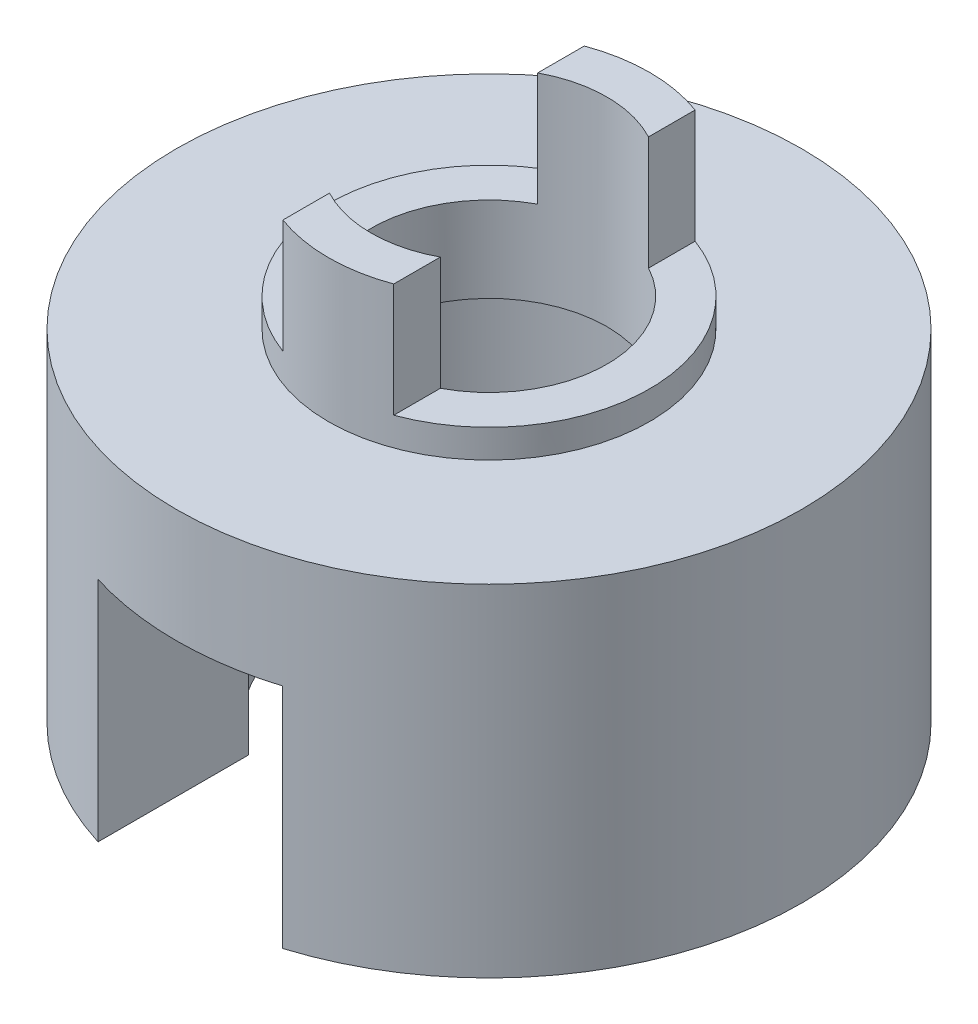
from build123d import *

# Parameters (mm, degrees)
SKETCH_1_R          = 11
SKETCH_1_R_2        = 4.15
EXTRUDE_1_DEPTH     = 2
EXTRUDE_START       = 5
SKETCH_1_3_R        = 5.65
SKETCH_1_3_R_2      = 4.15
EXTRUDE_2_DEPTH     = 5
CUT_EXTRUDE_1_DEPTH = 4
SKETCH_4_R          = 11
SKETCH_4_R_2        = 6.15
EXTRUDE_3_DEPTH     = 10
CUT_EXTRUDE_START   = -8
SKETCH_5_W          = 5.562300803
SKETCH_5_H          = 5
CUT_EXTRUDE_2_DEPTH = 8


with BuildPart() as part:
    # 草图1 → 凸台-拉伸1 (new body)
    with BuildSketch(Plane(origin=(0, 0, 0), x_dir=(1, 0, 0), z_dir=(0, 1, 0))):
        Circle(SKETCH_1_R)
        Circle(SKETCH_1_R_2, mode=Mode.SUBTRACT)
    extrude(amount=-EXTRUDE_1_DEPTH)

    # 草图1<3> → 凸台-拉伸2 (add)
    with BuildSketch(Plane(origin=(0, 0, 0), x_dir=(1, 0, 0), z_dir=(0, 1, 0)).offset(EXTRUDE_START)):
        Circle(SKETCH_1_3_R)
        Circle(SKETCH_1_3_R_2, mode=Mode.SUBTRACT)
    extrude(amount=-EXTRUDE_2_DEPTH)

    # 草图2 → 切除-拉伸1 (cut)
    with BuildSketch(Plane(origin=(0, 5, 0), x_dir=(1, 0, 0), z_dir=(0, 1, 0))):
        with BuildLine():
            Line((1.95, 5.302829433), (1.95, 3.663331817))
            ThreePointArc((1.95, 3.663331817), (4.15, 0), (1.95, -3.663331817))
            Line((1.95, -3.663331817), (1.95, -5.302829433))
            ThreePointArc((1.95, -5.302829433), (5.65, 0), (1.95, 5.302829433))
        make_face()
        with BuildLine():
            Line((-1.95, 5.302829433), (-1.95, 3.663331817))
            ThreePointArc((-1.95, 3.663331817), (-4.15, 0), (-1.95, -3.663331817))
            Line((-1.95, -3.663331817), (-1.95, -5.302829433))
            ThreePointArc((-1.95, -5.302829433), (-5.65, 0), (-1.95, 5.302829433))
        make_face()
    extrude(amount=-CUT_EXTRUDE_1_DEPTH, mode=Mode.SUBTRACT)

    # 草图4 → 凸台-拉伸3 (add)
    with BuildSketch(Plane.XZ.offset(2)):
        Circle(SKETCH_4_R)
        Circle(SKETCH_4_R_2, mode=Mode.SUBTRACT)
    extrude(amount=EXTRUDE_3_DEPTH)

    # 草图5 → 切除-拉伸2 (cut)
    with BuildSketch(Plane.XZ.offset(12).offset(CUT_EXTRUDE_START)):
        with Locations((-8.400091582, 0)):
            Rectangle(SKETCH_5_W, SKETCH_5_H)
        with BuildLine():
            ThreePointArc((3.25, 10.508924778), (0, 11), (-3.25, 10.508924778))
            Line((-3.25, 10.508924778), (-3.25, 5.221110993))
            ThreePointArc((-3.25, 5.221110993), (0, 6.15), (3.25, 5.221110993))
            Line((3.25, 5.221110993), (3.25, 10.508924778))
        make_face()
    extrude(amount=CUT_EXTRUDE_2_DEPTH, mode=Mode.SUBTRACT)


solid = part.part
